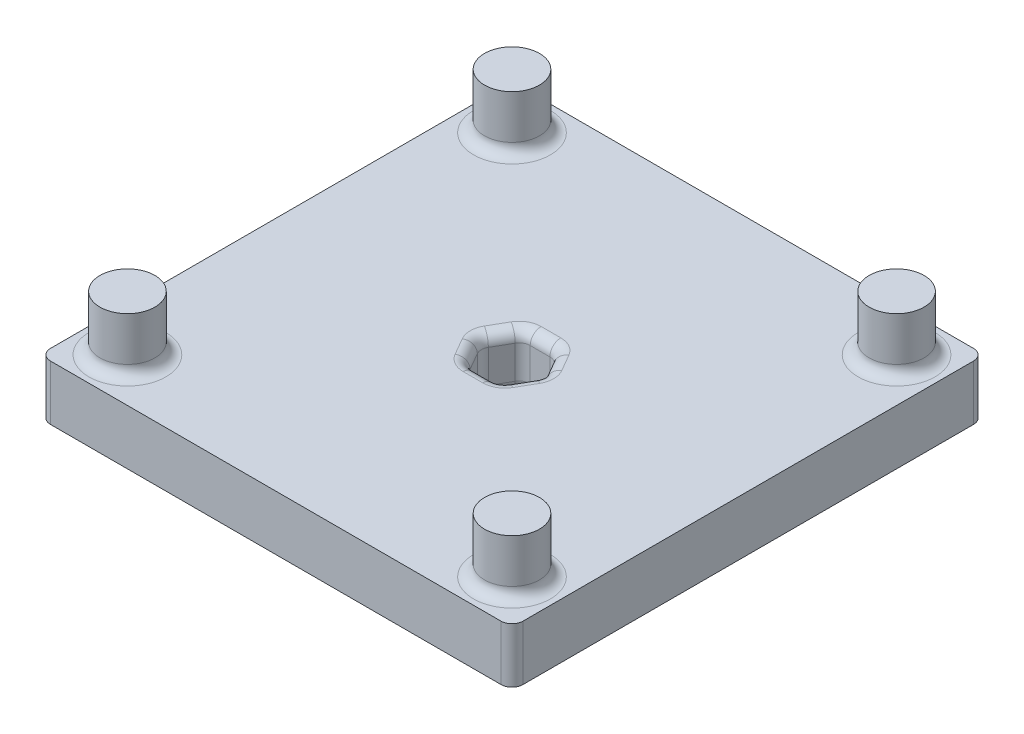
from build123d import *

# Parameters (mm, degrees)
SKETCH2_W           = 43
SKETCH2_H           = 43
BOSS_EXTRUDE1_DEPTH = 5
SKETCH2_3_R         = 2.5
BOSS_EXTRUDE2_DEPTH = 10
FILLET1_R           = 1
FILLET2_R           = 1
FILLET3_R           = 1


with BuildPart() as part:
    # Sketch2 → Boss-Extrude1 (new body)
    with BuildSketch(Plane(origin=(0, 0, 0), x_dir=(1, 0, 0), z_dir=(0, 1, 0))):
        Rectangle(SKETCH2_W, SKETCH2_H)
        Polygon((-1.472243186, -2.55), (-2.944486373, 0), (-1.472243186, 2.55), (1.472243186, 2.55), (2.944486373, 0), (1.472243186, -2.55), align=None, mode=Mode.SUBTRACT)
    extrude(amount=BOSS_EXTRUDE1_DEPTH)

    # Sketch2<3> → Boss-Extrude2 (add)
    with BuildSketch(Plane(origin=(0, 0, 0), x_dir=(1, 0, 0), z_dir=(0, 1, 0))):
        with Locations((17.5, -17.5)):
            Circle(SKETCH2_3_R)
        with Locations((17.5, 17.5)):
            Circle(SKETCH2_3_R)
        with Locations((-17.5, 17.5)):
            Circle(SKETCH2_3_R)
        with Locations((-17.5, -17.5)):
            Circle(SKETCH2_3_R)
    extrude(amount=BOSS_EXTRUDE2_DEPTH)

    # Fillet1
    fillet1_edges = [part.edges().sort_by_distance(p)[0] for p in [
        (-20, 5, -17.5),
        (15, 5, -17.5),
        (15, 5, 17.5),
        (-20, 5, 17.5),
    ]]
    fillet(fillet1_edges, radius=FILLET1_R)

    # Fillet2
    fillet2_edges = [part.edges().sort_by_distance(p)[0] for p in [
        (-1.472243186, 2.5, -2.55),
        (1.472243186, 2.5, -2.55),
        (2.944486373, 2.5, 0),
        (1.472243186, 2.5, 2.55),
        (-1.472243186, 2.5, 2.55),
        (-2.944486373, 2.5, 0),
        (-21.5, 2.5, -21.5),
        (21.5, 2.5, -21.5),
        (21.5, 2.5, 21.5),
        (-21.5, 2.5, 21.5),
    ]]
    fillet(fillet2_edges, radius=FILLET2_R)

    # Fillet3
    fillet3_edges = [part.edges().sort_by_distance(p)[0] for p in [
        (1.394892917, 0, 2.416025404),
        (0, 0, 2.55),
        (-1.394892917, 0, 2.416025404),
        (-2.20836478, 0, 1.275),
        (-2.789785834, 5, 0),
        (-2.789785834, 0, 0),
        (-1.394892917, 5, 2.416025404),
        (1.394892917, 5, 2.416025404),
        (2.789785834, 5, 0),
        (2.789785834, 0, 0),
        (1.394892917, 5, -2.416025404),
        (1.394892917, 0, -2.416025404),
        (-1.394892917, 5, -2.416025404),
        (-1.394892917, 0, -2.416025404),
        (0, 5, 2.55),
        (2.20836478, 5, 1.275),
        (2.20836478, 5, -1.275),
        (0, 5, -2.55),
        (-2.20836478, 5, -1.275),
        (-2.20836478, 5, 1.275),
        (2.20836478, 0, 1.275),
        (2.20836478, 0, -1.275),
        (0, 0, -2.55),
        (-2.20836478, 0, -1.275),
    ]]
    fillet(fillet3_edges, radius=FILLET3_R)


solid = part.part
